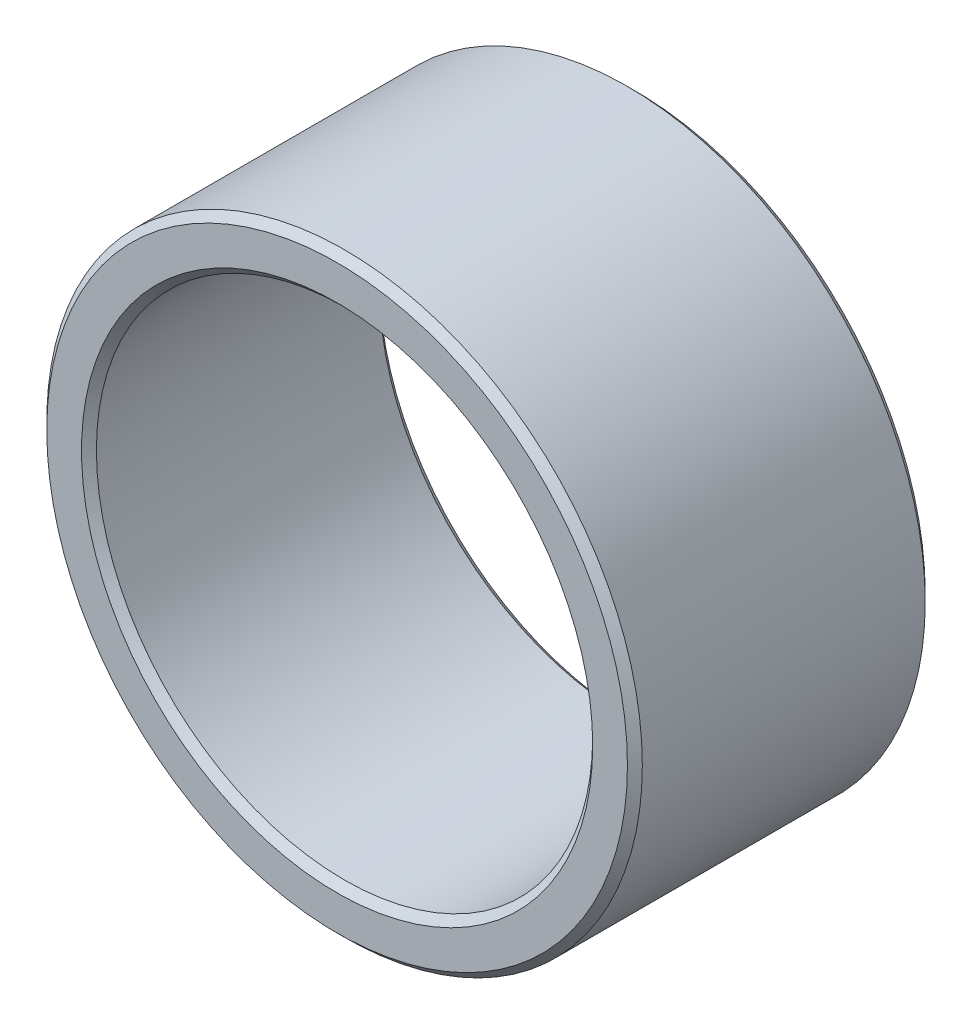
from build123d import *

# Parameters (mm, degrees)
SKETCH_1_R      = 12
SKETCH_1_R_2    = 10
EXTRUDE_1_DEPTH = 12
CHAMFER_1_SIZE  = 0.3


with BuildPart() as part:
    # 草图1 → 凸台-拉伸1 (new body)
    with BuildSketch(Plane.XY):
        Circle(SKETCH_1_R)
        Circle(SKETCH_1_R_2, mode=Mode.SUBTRACT)
    extrude(amount=EXTRUDE_1_DEPTH)

    # 倒角1
    chamfer_1_edges = [part.edges().sort_by_distance(p)[0] for p in [
        (-12, 0, 0),
        (-12, 0, 12),
        (-10, 0, 0),
        (-10, 0, 12),
    ]]
    chamfer(chamfer_1_edges, length=CHAMFER_1_SIZE)


solid = part.part
